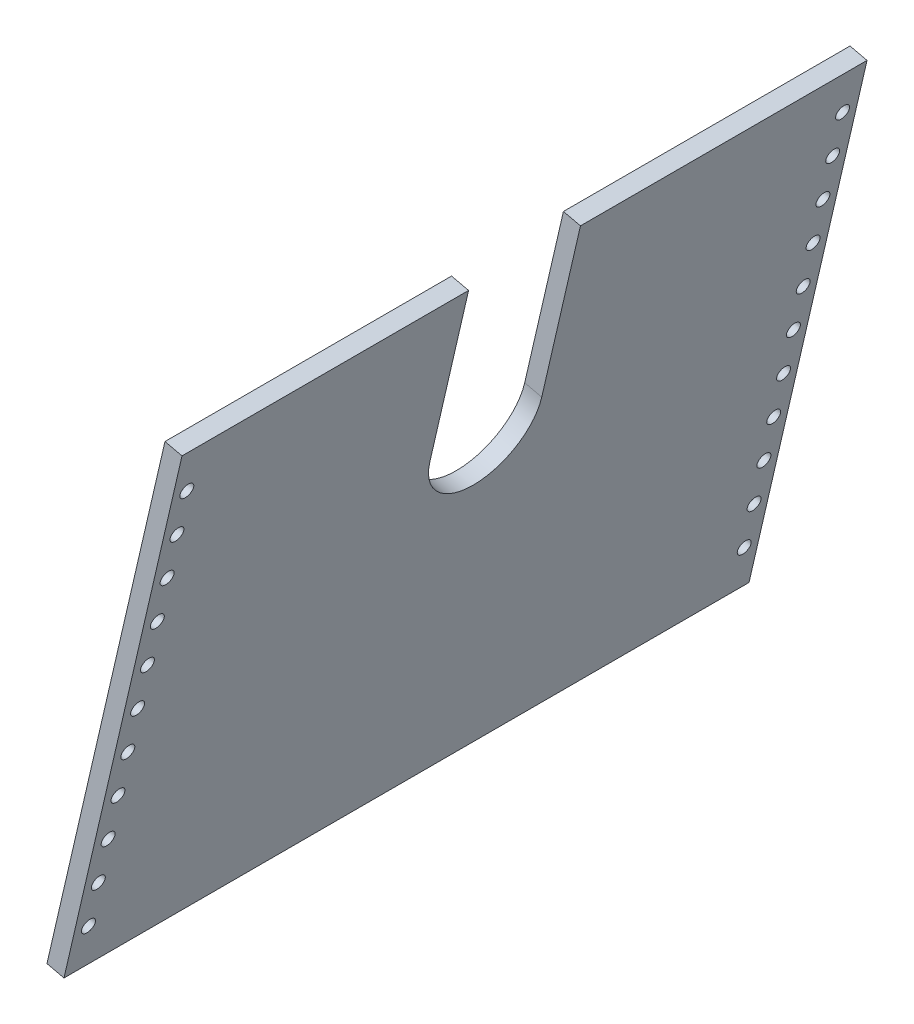
from build123d import *

# Parameters (mm, degrees)
BOSS_EXTRUDE1_DEPTH     = 398
CUT_EXTRUDE1_DEPTH      = 1867.759149714
CUT_EXTRUDE1_DEPTH_BACK = 1867.759149714
SKETCH3_R               = 3.96875
CUT_EXTRUDE3_DEPTH      = 1867.759149714


with BuildPart() as part:
    # Sketch1 → Boss-Extrude1 (new body)
    with BuildSketch(Plane.XY):
        Polygon((174.207835311, 1829.307995747), (105.642753947, 1532.32), (95.743154089, 1534.605502712), (164.308235453, 1831.593498459), align=None)
    extrude(amount=BOSS_EXTRUDE1_DEPTH)

    # Sketch2 → Cut-Extrude1 (cut, two sides: drawn at the far end of the back side and taken through both)
    with BuildSketch(Plane(origin=(-235.565521709, 54.384585889, 0), x_dir=(0, 0, -1), z_dir=(0.9743700647852336, -0.2249510543438718, 0)).offset(-CUT_EXTRUDE1_DEPTH_BACK)):
        with BuildLine():
            Line((-231.5, 1721.611186556), (-231.5, 1821.611186556))
            Line((-231.5, 1821.611186556), (-166.5, 1821.611186556))
            Line((-166.5, 1821.611186556), (-166.5, 1721.611186556))
            ThreePointArc((-166.5, 1721.611186556), (-199, 1689.111186556), (-231.5, 1721.611186556))
        make_face()
    extrude(amount=CUT_EXTRUDE1_DEPTH + CUT_EXTRUDE1_DEPTH_BACK, mode=Mode.SUBTRACT)

    # Sketch3 → Cut-Extrude3 (cut, through all)
    with BuildSketch(Plane(origin=(-235.565521709, 54.384585889, 0), x_dir=(0, 0, -1), z_dir=(0.9743700647852336, -0.2249510543438718, 0))):
        with Locations(Location((-389.5, 1669.211186556, 0), (0, 0, 90))):
            Circle(SKETCH3_R)
        with Locations(Location((-389.5, 1694.611186556, 0), (0, 0, 90))):
            Circle(SKETCH3_R)
        with Locations(Location((-389.5, 1720.011186556, 0), (0, 0, 90))):
            Circle(SKETCH3_R)
        with Locations(Location((-389.5, 1745.411186556, 0), (0, 0, 90))):
            Circle(SKETCH3_R)
        with Locations(Location((-389.5, 1770.811186556, 0), (0, 0, 90))):
            Circle(SKETCH3_R)
        with Locations(Location((-389.5, 1796.211186556, 0), (0, 0, 90))):
            Circle(SKETCH3_R)
        with Locations(Location((-389.5, 1542.211186556, 0), (0, 0, 90))):
            Circle(SKETCH3_R)
        with Locations(Location((-389.5, 1567.611186556, 0), (0, 0, 90))):
            Circle(SKETCH3_R)
        with Locations(Location((-389.5, 1593.011186556, 0), (0, 0, 90))):
            Circle(SKETCH3_R)
        with Locations(Location((-389.5, 1618.411186556, 0), (0, 0, 90))):
            Circle(SKETCH3_R)
        with Locations(Location((-389.5, 1643.811186556, 0), (0, 0, 90))):
            Circle(SKETCH3_R)
        with Locations(Location((-8.5, 1643.811186556, 0), (0, 0, 90))):
            Circle(SKETCH3_R)
        with Locations(Location((-8.5, 1618.411186556, 0), (0, 0, 90))):
            Circle(SKETCH3_R)
        with Locations(Location((-8.5, 1593.011186556, 0), (0, 0, 90))):
            Circle(SKETCH3_R)
        with Locations(Location((-8.5, 1567.611186556, 0), (0, 0, 90))):
            Circle(SKETCH3_R)
        with Locations(Location((-8.5, 1542.211186556, 0), (0, 0, 90))):
            Circle(SKETCH3_R)
        with Locations(Location((-8.5, 1796.211186556, 0), (0, 0, 90))):
            Circle(SKETCH3_R)
        with Locations(Location((-8.5, 1770.811186556, 0), (0, 0, 90))):
            Circle(SKETCH3_R)
        with Locations(Location((-8.5, 1745.411186556, 0), (0, 0, 90))):
            Circle(SKETCH3_R)
        with Locations(Location((-8.5, 1720.011186556, 0), (0, 0, 90))):
            Circle(SKETCH3_R)
        with Locations(Location((-8.5, 1694.611186556, 0), (0, 0, 90))):
            Circle(SKETCH3_R)
        with Locations(Location((-8.5, 1669.211186556, 0), (0, 0, 90))):
            Circle(SKETCH3_R)
    extrude(amount=-CUT_EXTRUDE3_DEPTH, mode=Mode.SUBTRACT)


solid = part.part
